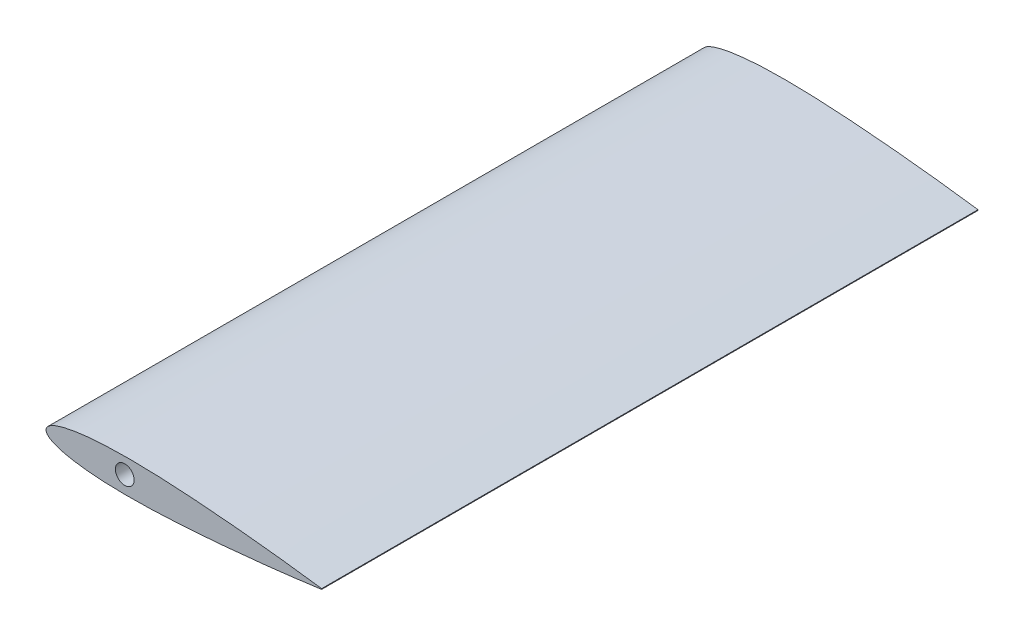
from build123d import *

# Parameters (mm, degrees)
BOSS_EXTRUDE4_DEPTH = 70
SKETCH8_R           = 1
CUT_EXTRUDE3_DEPTH  = 76.563989484


with BuildPart() as part:
    # Sketch7 → Boss-Extrude4 (new body)
    with BuildSketch(Plane.XY):
        with BuildLine():
            Line((1, -0.10458), (1, -0.030492))
            add(Edge.make_bspline(
                [(1, -0.030492), (0.4391072, 0.048291643), (-1.674403185, 0.334004631), (-4.617530754, 0.684240443), (-8.132656486, 1.046660581), (-10.797969598, 1.284679919), (-13.346212552, 1.471490986), (-15.458523396, 1.594302147), (-17.534124999, 1.675667087), (-19.529591939, 1.706588124), (-21.218108073, 1.682770802), (-22.598496265, 1.62014828), (-23.68140911, 1.53967512), (-24.671353768, 1.432175628), (-25.432681359, 1.318284621), (-25.987666395, 1.213155291), (-26.36247535, 1.13107875), (-26.707765564, 1.043628683), (-27.022774053, 0.951196852), (-27.306806225, 0.854090221), (-27.559256366, 0.752644178), (-27.779624738, 0.647151373), (-27.967491511, 0.537831437), (-28.122637923, 0.424869691), (-28.244764188, 0.308080317), (-28.333575795, 0.187132471), (-28.387875352, 0.061434974), (-28.405910061, -0.067536), (-28.387875352, -0.196506974), (-28.333575795, -0.322204471), (-28.244764188, -0.443152317), (-28.122637923, -0.559941691), (-27.967491511, -0.672903437), (-27.779624738, -0.782223373), (-27.559256366, -0.887716178), (-27.306806225, -0.989162221), (-27.022774053, -1.086268852), (-26.707765564, -1.178700683), (-26.36247535, -1.26615075), (-25.845317635, -1.379399155), (-25.128587685, -1.503940817), (-24.18858799, -1.624259365), (-22.953504403, -1.736332976), (-21.40315583, -1.815152516), (-19.299544677, -1.84491037), (-17.068129243, -1.798767021), (-14.756327199, -1.692559872), (-12.641605147, -1.558113836), (-10.329512475, -1.378613782), (-8.303516398, -1.19440739), (-5.692375718, -0.932615266), (-3.109793095, -0.64378772), (-0.644324126, -0.330601026), (0.586969476, -0.162396474), (0.948583439, -0.111802029), (1, -0.10458)],
                knots=[0, 0, 0, 0, 0.028342901, 0.106722049, 0.148306055, 0.205171367, 0.2406214, 0.276160573, 0.311047092, 0.344559266, 0.37601757, 0.395537659, 0.413698812, 0.430349273, 0.445356904, 0.452209372, 0.458611567, 0.464554044, 0.47002985, 0.475034902, 0.479569141, 0.483636857, 0.487250263, 0.490431338, 0.493218828, 0.495674086, 0.497891368, 0.5, 0.502108632, 0.504325914, 0.506781172, 0.509568662, 0.512749737, 0.516363143, 0.520430859, 0.524965098, 0.52997015, 0.535445956, 0.541388433, 0.547790628, 0.561933981, 0.577778559, 0.595202024, 0.62398243, 0.655440734, 0.700464146, 0.735649713, 0.771241831, 0.806495957, 0.851693945, 0.873039495, 0.937813387, 0.981728388, 0.997401831, 1, 1, 1, 1], degree=3))
        make_face()
    extrude(amount=BOSS_EXTRUDE4_DEPTH)

    # Sketch8 → Cut-Extrude3 (cut, through all)
    with BuildSketch(Plane.XY.offset(70)):
        with Locations((-20, 0)):
            Circle(SKETCH8_R)
    extrude(amount=-CUT_EXTRUDE3_DEPTH, mode=Mode.SUBTRACT)


solid = part.part
